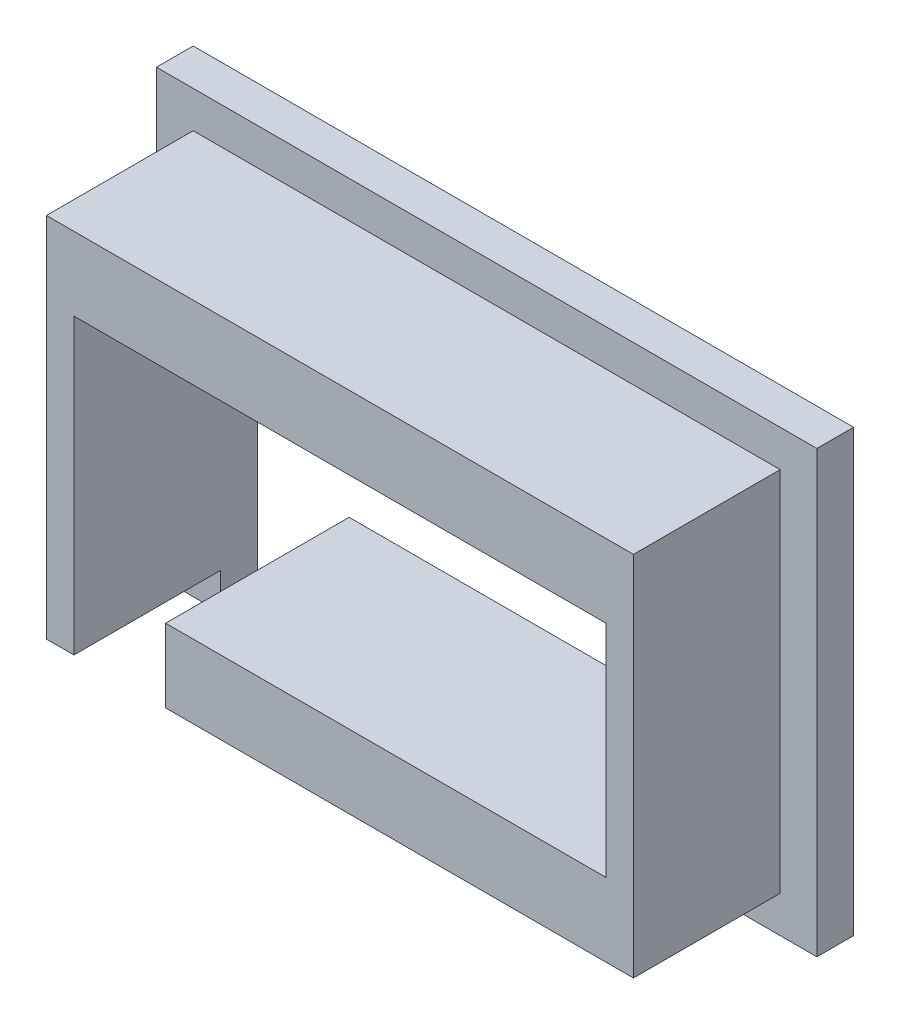
from build123d import *

# Parameters (mm, degrees)
SKETCH1_W           = 32
SKETCH1_H           = 20
SKETCH1_W_2         = 29
SKETCH1_H_2         = 12
BOSS_EXTRUDE1_DEPTH = 10
SKETCH2_W           = 36
SKETCH2_H           = 24
SKETCH2_W_2         = 32
SKETCH2_H_2         = 20
BOSS_EXTRUDE2_DEPTH = 2
SKETCH3_W           = 5
SKETCH3_H           = 6
CUT_EXTRUDE2_DEPTH  = 24.832750576


with BuildPart() as part:
    # Sketch1 → Boss-Extrude1 (new body)
    with BuildSketch(Plane.XY):
        Rectangle(SKETCH1_W, SKETCH1_H)
        Rectangle(SKETCH1_W_2, SKETCH1_H_2, mode=Mode.SUBTRACT)
    extrude(amount=BOSS_EXTRUDE1_DEPTH)

    # Sketch2 → Boss-Extrude2 (add)
    with BuildSketch(Plane(origin=(0, 0, 0), x_dir=(-1, 0, 0), z_dir=(0, 0, -1))):
        Rectangle(SKETCH2_W, SKETCH2_H)
        Rectangle(SKETCH2_W_2, SKETCH2_H_2, mode=Mode.SUBTRACT)
    extrude(amount=-BOSS_EXTRUDE2_DEPTH)

    # Sketch3 → Cut-Extrude2 (cut, through all)
    with BuildSketch(Plane(origin=(0, 0, 0), x_dir=(-1, 0, 0), z_dir=(0, 0, -1))):
        with Locations((12, -9)):
            Rectangle(SKETCH3_W, SKETCH3_H)
    extrude(amount=-CUT_EXTRUDE2_DEPTH, mode=Mode.SUBTRACT)


solid = part.part
